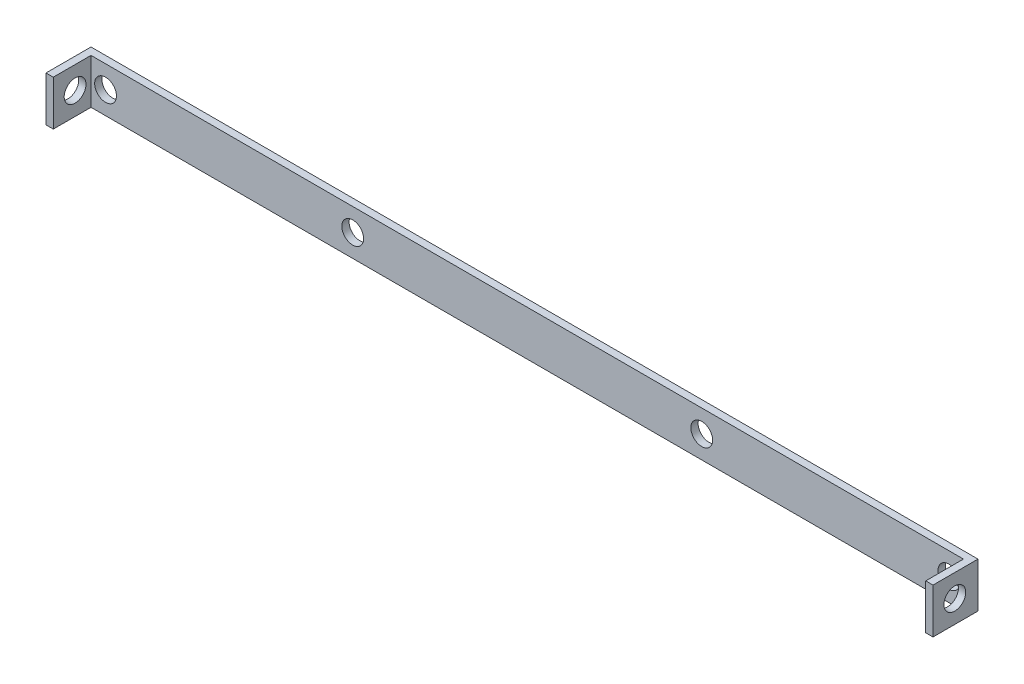
from build123d import *

# Parameters (mm, degrees)
SKETCH1_W           = 96.825
SKETCH1_H           = 4.9125
BOSS_EXTRUDE1_DEPTH = 4.9125
SHELL1_T            = -0.79375
SKETCH2_R           = 1.190625
CUT_EXTRUDE1_DEPTH  = 49.649433932
SKETCH3_R           = 1.190625
CUT_EXTRUDE2_DEPTH  = 97.98064985


with BuildPart() as part:
    # Sketch1 → Boss-Extrude1 (new body)
    with BuildSketch(Plane.XY):
        Rectangle(SKETCH1_W, SKETCH1_H)
    extrude(amount=BOSS_EXTRUDE1_DEPTH)

    # Shell1
    shell1_openings = [part.faces().sort_by_distance(p)[0] for p in [
        (0, 0, 4.9125),
        (0, -2.45625, 2.45625),
        (0, 2.45625, 2.45625),
    ]]
    offset(amount=SHELL1_T, openings=shell1_openings, kind=Kind.INTERSECTION)

    # Sketch2 → Cut-Extrude1 (cut, through all)
    with BuildSketch(Plane.XY.offset(0.79375)):
        with Locations((-46.03125, 0)):
            Circle(SKETCH2_R)
        with Locations((-19.05, 0)):
            Circle(SKETCH2_R)
        with Locations((19.05, 0)):
            Circle(SKETCH2_R)
        with Locations((46.03125, 0)):
            Circle(SKETCH2_R)
    extrude(amount=-CUT_EXTRUDE1_DEPTH, mode=Mode.SUBTRACT)

    # Sketch3 → Cut-Extrude2 (cut, through all)
    with BuildSketch(Plane.ZY.offset(48.4125)):
        with Locations((2.53125, 0)):
            Circle(SKETCH3_R)
    extrude(amount=-CUT_EXTRUDE2_DEPTH, mode=Mode.SUBTRACT)


solid = part.part
